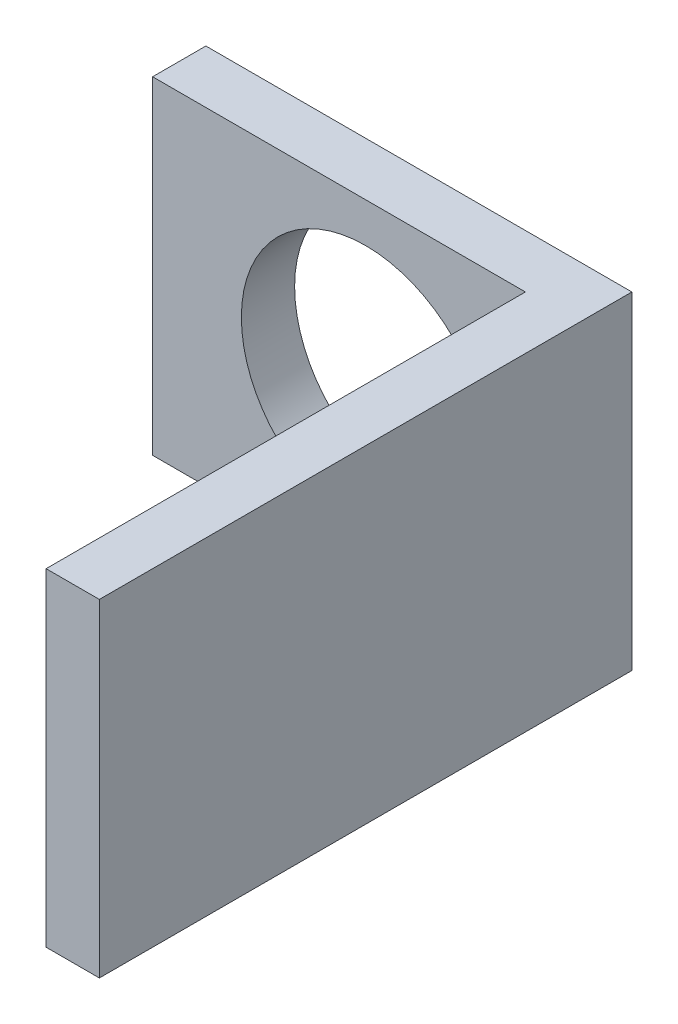
from build123d import *

# Parameters (mm, degrees)
SKETCH1_W           = 10.5
SKETCH1_H           = 9.235397934
SKETCH1_R           = 3.5
BOSS_EXTRUDE1_DEPTH = 1.5
SKETCH1_3_W         = 1.5
SKETCH1_3_H         = 9.235397934
BOSS_EXTRUDE2_DEPTH = 15


with BuildPart() as part:
    # Sketch1 → Boss-Extrude1 (new body)
    with BuildSketch(Plane.XY):
        with Locations((-0.75, 0)):
            Rectangle(SKETCH1_W, SKETCH1_H)
        Circle(SKETCH1_R, mode=Mode.SUBTRACT)
    extrude(amount=BOSS_EXTRUDE1_DEPTH)

    # Sketch1<3> → Boss-Extrude2 (add)
    with BuildSketch(Plane.XY):
        with Locations((5.25, 0)):
            Rectangle(SKETCH1_3_W, SKETCH1_3_H)
    extrude(amount=BOSS_EXTRUDE2_DEPTH)


solid = part.part
